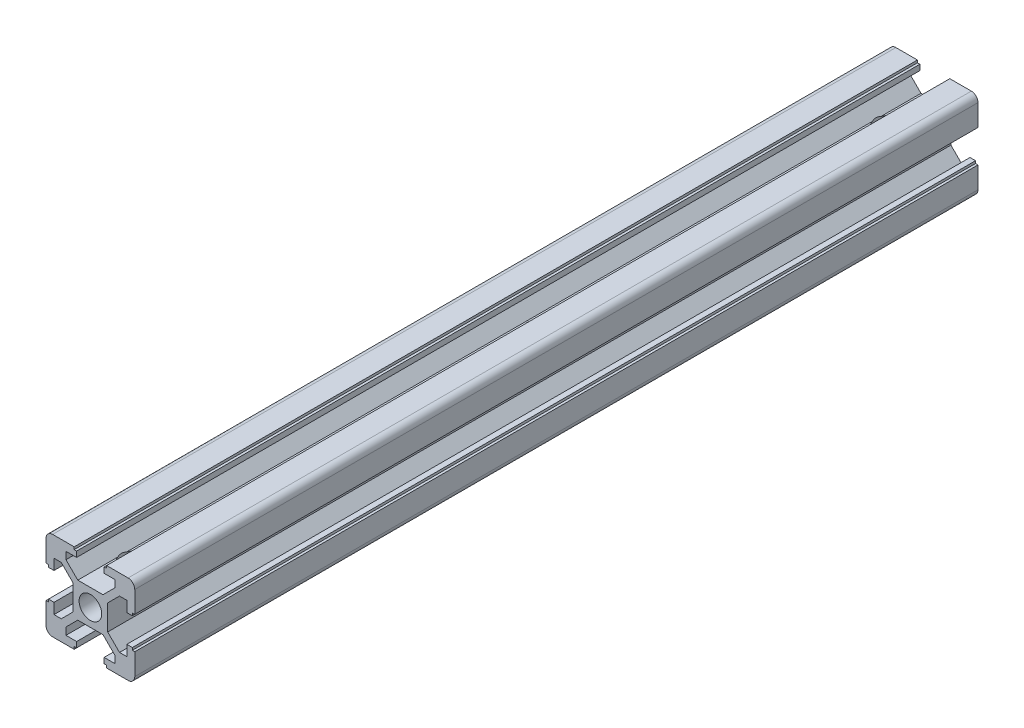
from build123d import *

# Parameters (mm, degrees)
SKETCH_2_R          = 2.55
EXTRUDE_1_DEPTH     = 190
SKETCH_3_R          = 3
CUT_EXTRUDE_1_DEPTH = 192.311264697
SKETCH_4_R          = 2.5
CUT_EXTRUDE_2_DEPTH = 192.311264796
SKETCH_5_R          = 3
CUT_EXTRUDE_3_DEPTH = 192.311264796


with BuildPart() as part:
    # 草图2 → 凸台-拉伸1 (new body)
    with BuildSketch(Plane.XY):
        with BuildLine():
            Line((-3.9, 2.839339828), (-6.560660172, 5.5))
            Line((-6.560660172, 5.5), (-8.2, 5.5))
            Line((-8.2, 5.5), (-8.2, 3.1))
            Line((-8.2, 3.1), (-9.45, 3.1))
            Line((-9.45, 3.1), (-9.45, 3.65))
            Line((-9.45, 3.65), (-10, 3.65))
            Line((-10, 3.65), (-10, 8.5))
            ThreePointArc((-10, 8.5), (-9.560660172, 9.560660172), (-8.5, 10))
            Line((-8.5, 10), (-3.65, 10))
            Line((-3.65, 10), (-3.65, 9.45))
            Line((-3.65, 9.45), (-3.1, 9.45))
            Line((-3.1, 9.45), (-3.1, 8.2))
            Line((-3.1, 8.2), (-5.5, 8.2))
            Line((-5.5, 8.2), (-5.5, 6.560660172))
            Line((-5.5, 6.560660172), (-2.839339828, 3.9))
            Line((-2.839339828, 3.9), (2.839339828, 3.9))
            Line((2.839339828, 3.9), (5.5, 6.560660172))
            Line((5.5, 6.560660172), (5.5, 8.2))
            Line((5.5, 8.2), (3.1, 8.2))
            Line((3.1, 8.2), (3.1, 9.45))
            Line((3.1, 9.45), (3.65, 9.45))
            Line((3.65, 9.45), (3.65, 10))
            Line((3.65, 10), (8.5, 10))
            ThreePointArc((8.5, 10), (9.560660172, 9.560660172), (10, 8.5))
            Line((10, 8.5), (10, 3.65))
            Line((10, 3.65), (9.45, 3.65))
            Line((9.45, 3.65), (9.45, 3.1))
            Line((9.45, 3.1), (8.2, 3.1))
            Line((8.2, 3.1), (8.2, 5.5))
            Line((8.2, 5.5), (6.560660172, 5.5))
            Line((6.560660172, 5.5), (3.9, 2.839339828))
            Line((3.9, 2.839339828), (3.9, -2.839339828))
            Line((3.9, -2.839339828), (6.560660172, -5.5))
            Line((6.560660172, -5.5), (8.2, -5.5))
            Line((8.2, -5.5), (8.2, -3.1))
            Line((8.2, -3.1), (9.45, -3.1))
            Line((9.45, -3.1), (9.45, -3.65))
            Line((9.45, -3.65), (10, -3.65))
            Line((10, -3.65), (10, -8.5))
            ThreePointArc((10, -8.5), (9.560660172, -9.560660172), (8.5, -10))
            Line((8.5, -10), (3.65, -10))
            Line((3.65, -10), (3.65, -9.45))
            Line((3.65, -9.45), (3.1, -9.45))
            Line((3.1, -9.45), (3.1, -8.2))
            Line((3.1, -8.2), (5.5, -8.2))
            Line((5.5, -8.2), (5.5, -6.560660172))
            Line((5.5, -6.560660172), (2.839339828, -3.9))
            Line((2.839339828, -3.9), (-2.839339828, -3.9))
            Line((-2.839339828, -3.9), (-5.5, -6.560660172))
            Line((-5.5, -6.560660172), (-5.5, -8.2))
            Line((-5.5, -8.2), (-3.1, -8.2))
            Line((-3.1, -8.2), (-3.1, -9.45))
            Line((-3.1, -9.45), (-3.65, -9.45))
            Line((-3.65, -9.45), (-3.65, -10))
            Line((-3.65, -10), (-8.5, -10))
            ThreePointArc((-8.5, -10), (-9.560660172, -9.560660172), (-10, -8.5))
            Line((-10, -8.5), (-10, -3.65))
            Line((-10, -3.65), (-9.45, -3.65))
            Line((-9.45, -3.65), (-9.45, -3.1))
            Line((-9.45, -3.1), (-8.2, -3.1))
            Line((-8.2, -3.1), (-8.2, -5.5))
            Line((-8.2, -5.5), (-6.560660172, -5.5))
            Line((-6.560660172, -5.5), (-3.9, -2.839339828))
            Line((-3.9, -2.839339828), (-3.9, 2.839339828))
        make_face()
        Circle(SKETCH_2_R, mode=Mode.SUBTRACT)
    extrude(amount=EXTRUDE_1_DEPTH)

    # 草图3 → 切除-拉伸1 (cut, through all)
    with BuildSketch(Plane.XZ.offset(10)):
        with Locations(Location((0, 10, 0), (0, 0, 18.835996158))):
            Circle(SKETCH_3_R)
    extrude(amount=-CUT_EXTRUDE_1_DEPTH, mode=Mode.SUBTRACT)

    # 草图4 → 切除-拉伸2 (cut, through all)
    with BuildSketch(Plane(origin=(0, 10, 0), x_dir=(1, 0, 0), z_dir=(0, 1, 0))):
        with Locations(Location((0, -48, 0), (0, 0, 270))):
            Circle(SKETCH_4_R)
        with Locations(Location((0, -89, 0), (0, 0, 270))):
            Circle(SKETCH_4_R)
    extrude(amount=-CUT_EXTRUDE_2_DEPTH, mode=Mode.SUBTRACT)

    # 草图5 → 切除-拉伸3 (cut, through all)
    with BuildSketch(Plane(origin=(0, 10, 0), x_dir=(1, 0, 0), z_dir=(0, 1, 0))):
        with Locations(Location((0, -180, 0), (0, 0, 198.835996158))):
            Circle(SKETCH_5_R)
    extrude(amount=-CUT_EXTRUDE_3_DEPTH, mode=Mode.SUBTRACT)


solid = part.part
